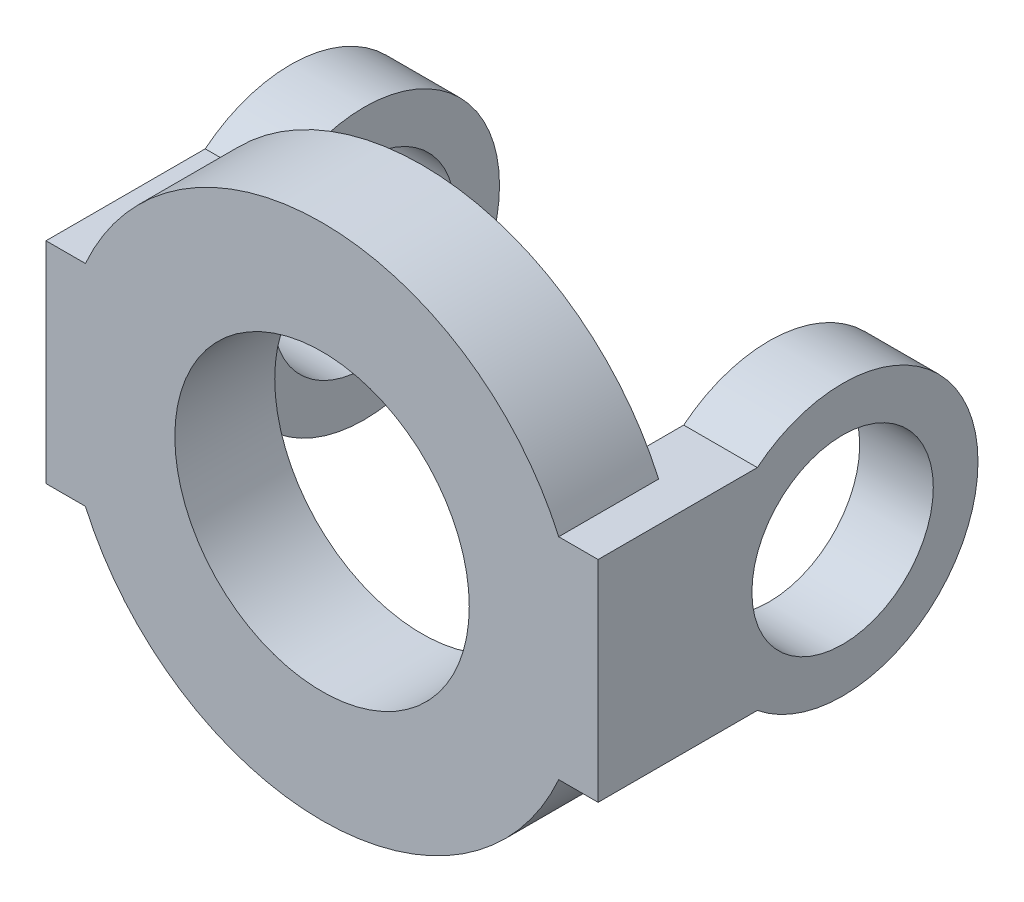
from build123d import *

# Parameters (mm, degrees)
SKETCH1_R      = 56
EXTRUDE1_DEPTH = 38
EXTRUDE2_DEPTH = 28
SKETCH3_R      = 34.5
EXTRUDE3_DEPTH = 256.234206172


with BuildPart() as part:
    # Sketch1 → Extrude1 (new body)
    with BuildSketch(Plane.XY):
        with BuildLine():
            Line((-105, -40), (-90.012499132, -40))
            ThreePointArc((-90.012499132, -40), (0, -98.5), (90.012499132, -40))
            Line((90.012499132, -40), (105, -40))
            Line((105, -40), (105, 40))
            Line((105, 40), (90.012499132, 40))
            ThreePointArc((90.012499132, 40), (0, 98.5), (-90.012499132, 40))
            Line((-90.012499132, 40), (-105, 40))
            Line((-105, 40), (-105, -40))
        make_face()
        Circle(SKETCH1_R, mode=Mode.SUBTRACT)
    extrude(amount=EXTRUDE1_DEPTH)

    # Sketch2 → Extrude2 (add)
    with BuildSketch(Plane.ZY.offset(105)):
        with BuildLine():
            Line((0, 40), (-22.561596833, 40))
            ThreePointArc((-22.561596833, 40), (-106.5, 0), (-22.561596833, -40))
            Line((-22.561596833, -40), (0, -40))
            Line((0, -40), (0, 40))
        make_face()
    extrude2 = extrude(amount=-EXTRUDE2_DEPTH)

    # Mirror1: Extrude2 across plane
    add(extrude2.mirror(Plane(origin=(0, 0, 0), x_dir=(0, 0, 1), z_dir=(1, 0, 0))))

    # Sketch3 → Extrude3 (cut, through all)
    with BuildSketch(Plane.ZY.offset(105)):
        with Locations((-55, 0)):
            Circle(SKETCH3_R)
    extrude(amount=-EXTRUDE3_DEPTH, mode=Mode.SUBTRACT)


solid = part.part
